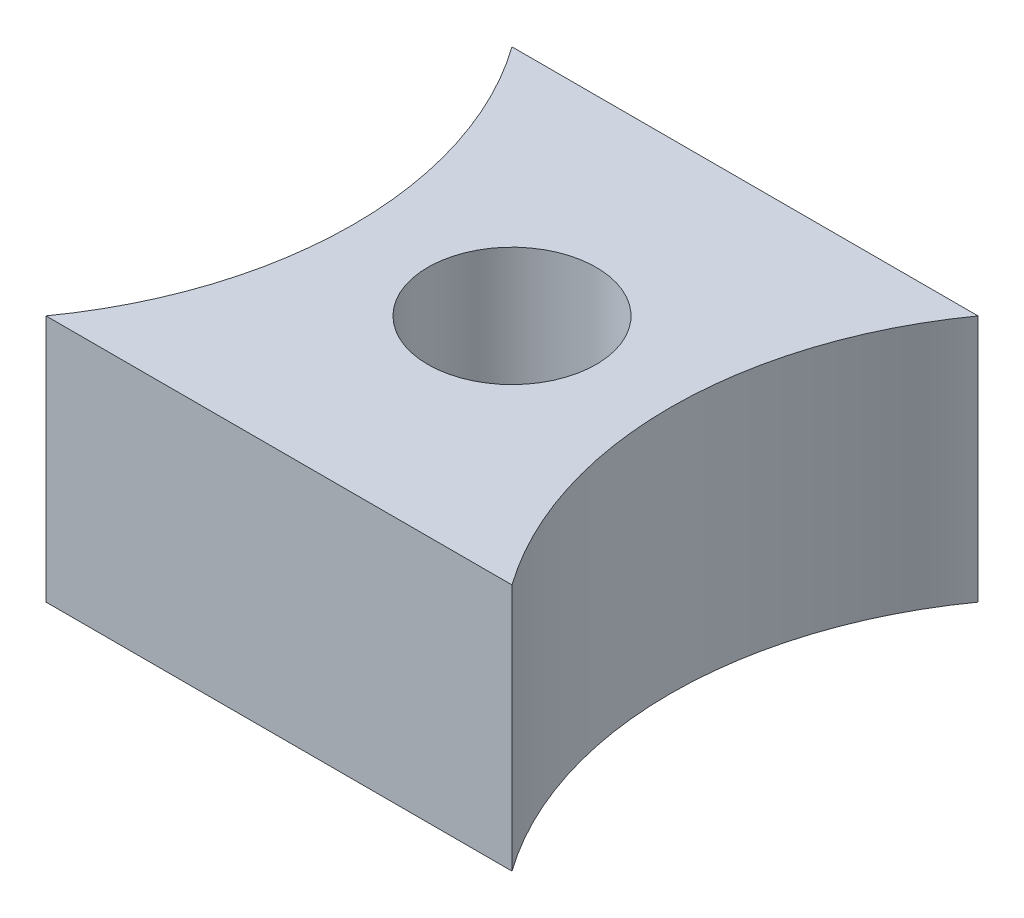
from build123d import *

# Parameters (mm, degrees)
BOSS_EXTRUDE1_DEPTH = 6.33
SKETCH2_R           = 2.15
CUT_EXTRUDE1_DEPTH  = 11.529667611


with BuildPart() as part:
    # Sketch1 → Boss-Extrude1 (new body)
    with BuildSketch(Plane(origin=(0, 0, 0), x_dir=(1, 0, 0), z_dir=(0, 1, 0))):
        with BuildLine():
            Line((-5.95, -5.95), (5.95, -5.95))
            ThreePointArc((5.95, -5.95), (4.046256646, 0), (5.95, 5.95))
            Line((5.95, 5.95), (-5.95, 5.95))
            ThreePointArc((-5.95, 5.95), (-4.046256646, 0), (-5.95, -5.95))
        make_face()
    extrude(amount=-BOSS_EXTRUDE1_DEPTH)

    # Sketch2 → Cut-Extrude1 (cut, through all)
    with BuildSketch(Plane(origin=(0, 0, 0), x_dir=(1, 0, 0), z_dir=(0, 1, 0))):
        with Locations(Location((0, 0, 0), (0, 0, 270))):
            Circle(SKETCH2_R)
    extrude(amount=-CUT_EXTRUDE1_DEPTH, mode=Mode.SUBTRACT)


solid = part.part
